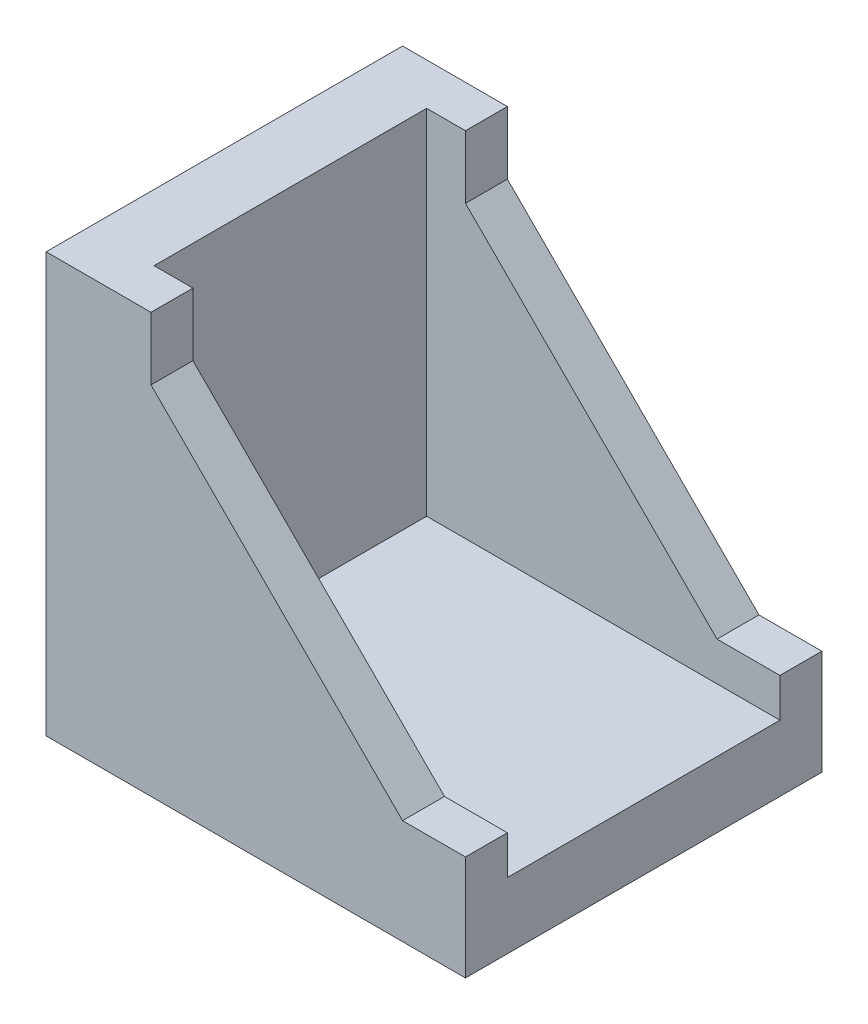
from build123d import *

# Parameters (mm, degrees)
EXTRUDE_1_DEPTH     = 17
SKETCH_2_W          = 13
SKETCH_2_H          = 17.49202682
CUT_EXTRUDE_1_DEPTH = 16.85


with BuildPart() as part:
    # 草图1 → 凸台-拉伸1 (new body)
    with BuildSketch(Plane.XY):
        Polygon((0, 0), (20, 0), (20, 5), (17, 5), (5, 17), (5, 20), (0, 20), align=None)
    extrude(amount=EXTRUDE_1_DEPTH)

    # 草图2 → 切除-拉伸1 (cut)
    with BuildSketch(Plane(origin=(20, 0, 0), x_dir=(0, 0, -1), z_dir=(1, 0, 0))):
        with Locations((-8.5, 11.89601341)):
            Rectangle(SKETCH_2_W, SKETCH_2_H)
    extrude(amount=-CUT_EXTRUDE_1_DEPTH, mode=Mode.SUBTRACT)


solid = part.part
